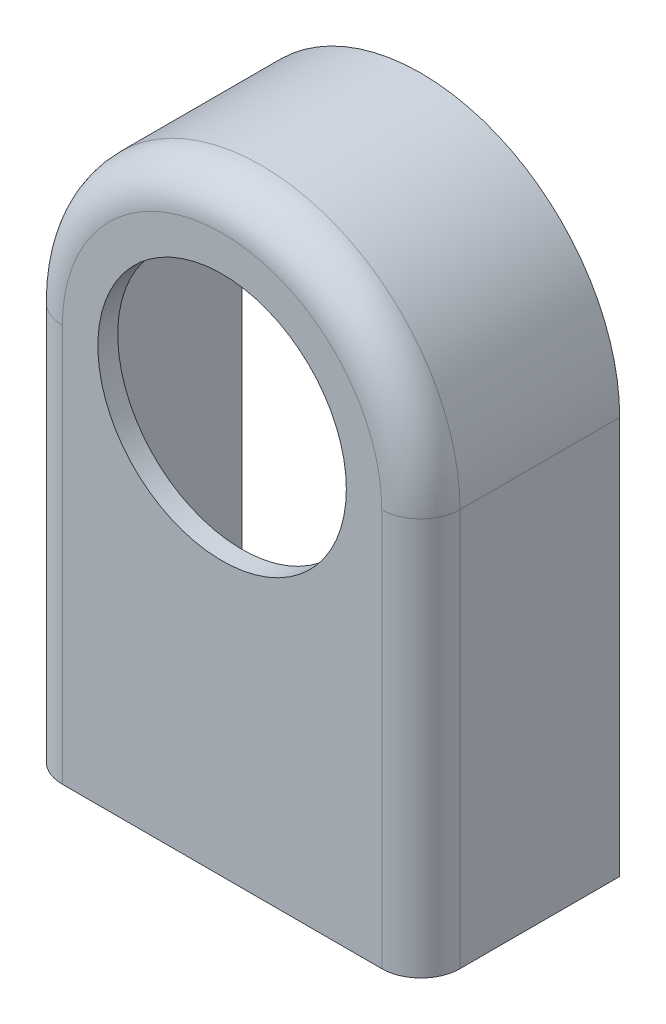
from build123d import *

# Parameters (mm, degrees)
BOSS_EXTRUDE1_DEPTH = 50.8
FILLET1_R           = 10
SHELL1_T            = -5.08
SKETCH3_R           = 31.75
CUT_EXTRUDE2_DEPTH  = 125.434078933


with BuildPart() as part:
    # Sketch2 → Boss-Extrude1 (new body)
    with BuildSketch(Plane.XY):
        with BuildLine():
            Line((-50.8, 0), (-50.8, -101.6))
            Line((-50.8, -101.6), (50.8, -101.6))
            Line((50.8, -101.6), (50.8, 0))
            ThreePointArc((50.8, 0), (0, 50.8), (-50.8, 0))
        make_face()
    extrude(amount=BOSS_EXTRUDE1_DEPTH)

    # Fillet1
    fillet1_edges = [part.edges().sort_by_distance(p)[0] for p in [
        (50.8, -50.8, 50.8),
        (0, 50.8, 50.8),
        (-50.8, -50.8, 50.8),
    ]]
    fillet(fillet1_edges, radius=FILLET1_R)

    # Shell1
    shell1_openings = [part.faces().sort_by_distance(p)[0] for p in [
        (0, -30.396611795, 0),
    ]]
    offset(amount=SHELL1_T, openings=shell1_openings, kind=Kind.INTERSECTION)

    # Sketch3 → Cut-Extrude2 (cut, through all)
    with BuildSketch(Plane.XY.offset(50.8)):
        Circle(SKETCH3_R)
    extrude(amount=-CUT_EXTRUDE2_DEPTH, mode=Mode.SUBTRACT)


solid = part.part
